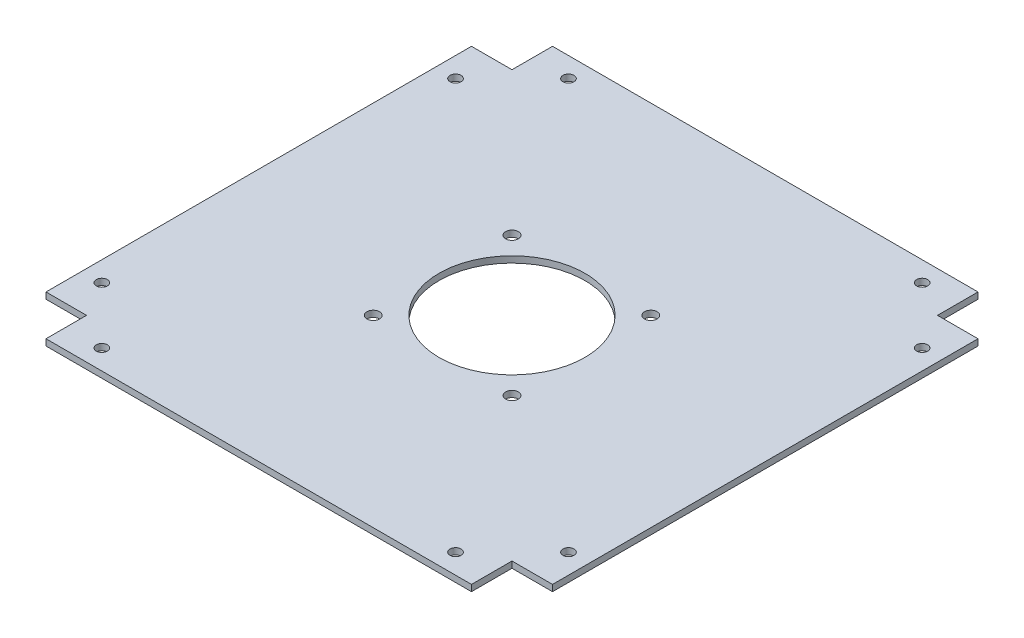
from build123d import *

# Parameters (mm, degrees)
SKETCH1_W           = 254
SKETCH1_H           = 254
BOSS_EXTRUDE1_DEPTH = 1.5875
SKETCH2_W           = 20.32
SKETCH2_H           = 20.32
CUT_EXTRUDE1_DEPTH  = 3.175
SKETCH3_R           = 36.576
CUT_EXTRUDE2_DEPTH  = 3.175
SKETCH4_R           = 3.175
CUT_EXTRUDE3_DEPTH  = 3.175
SKETCH5_R           = 2.778125
CUT_EXTRUDE4_DEPTH  = 3.175


with BuildPart() as part:
    # Sketch1 → Boss-Extrude1 (new, symmetric)
    with BuildSketch(Plane(origin=(0, 0, 0), x_dir=(1, 0, 0), z_dir=(0, 1, 0))):
        Rectangle(SKETCH1_W, SKETCH1_H)
    extrude(amount=BOSS_EXTRUDE1_DEPTH, both=True)

    # Sketch2 → Cut-Extrude1 (cut)
    with BuildSketch(Plane(origin=(0, 1.5875, 0), x_dir=(1, 0, 0), z_dir=(0, 1, 0))):
        with Locations((116.84, 116.84)):
            Rectangle(SKETCH2_W, SKETCH2_H)
        with Locations((-116.84, 116.84)):
            Rectangle(SKETCH2_W, SKETCH2_H)
        with Locations((116.84, -116.84)):
            Rectangle(SKETCH2_W, SKETCH2_H)
        with Locations((-116.84, -116.84)):
            Rectangle(SKETCH2_W, SKETCH2_H)
    extrude(amount=-CUT_EXTRUDE1_DEPTH, mode=Mode.SUBTRACT)

    # Sketch3 → Cut-Extrude2 (cut)
    with BuildSketch(Plane(origin=(0, 1.5875, 0), x_dir=(1, 0, 0), z_dir=(0, 1, 0))):
        with Locations(Location((0, 0, 0), (0, 0, 270))):
            Circle(SKETCH3_R)
    extrude(amount=-CUT_EXTRUDE2_DEPTH, mode=Mode.SUBTRACT)

    # Sketch4 → Cut-Extrude3 (cut)
    with BuildSketch(Plane(origin=(0, 1.5875, 0), x_dir=(1, 0, 0), z_dir=(0, 1, 0))):
        with Locations(Location((-34.80054, 34.80054, 0), (0, 0, 270))):
            Circle(SKETCH4_R)
        with Locations(Location((34.80054, 34.80054, 0), (0, 0, 90))):
            Circle(SKETCH4_R)
        with Locations(Location((34.80054, -34.80054, 0), (0, 0, 270))):
            Circle(SKETCH4_R)
        with Locations(Location((-34.80054, -34.80054, 0), (0, 0, 90))):
            Circle(SKETCH4_R)
    extrude(amount=-CUT_EXTRUDE3_DEPTH, mode=Mode.SUBTRACT)

    # Sketch5 → Cut-Extrude4 (cut)
    with BuildSketch(Plane(origin=(0, 1.5875, 0), x_dir=(1, 0, 0), z_dir=(0, 1, 0))):
        with Locations(Location((-117, 88.68, 0), (0, 0, 270))):
            Circle(SKETCH5_R)
        with Locations(Location((-88.68, 117, 0), (0, 0, 270))):
            Circle(SKETCH5_R)
        with Locations(Location((117, 88.68, 0), (0, 0, 90))):
            Circle(SKETCH5_R)
        with Locations(Location((88.68, 117, 0), (0, 0, 90))):
            Circle(SKETCH5_R)
        with Locations(Location((117, -88.68, 0), (0, 0, 270))):
            Circle(SKETCH5_R)
        with Locations(Location((88.68, -117, 0), (0, 0, 270))):
            Circle(SKETCH5_R)
        with Locations(Location((-88.68, -117, 0), (0, 0, 90))):
            Circle(SKETCH5_R)
        with Locations(Location((-117, -88.68, 0), (0, 0, 90))):
            Circle(SKETCH5_R)
    extrude(amount=-CUT_EXTRUDE4_DEPTH, mode=Mode.SUBTRACT)


solid = part.part
